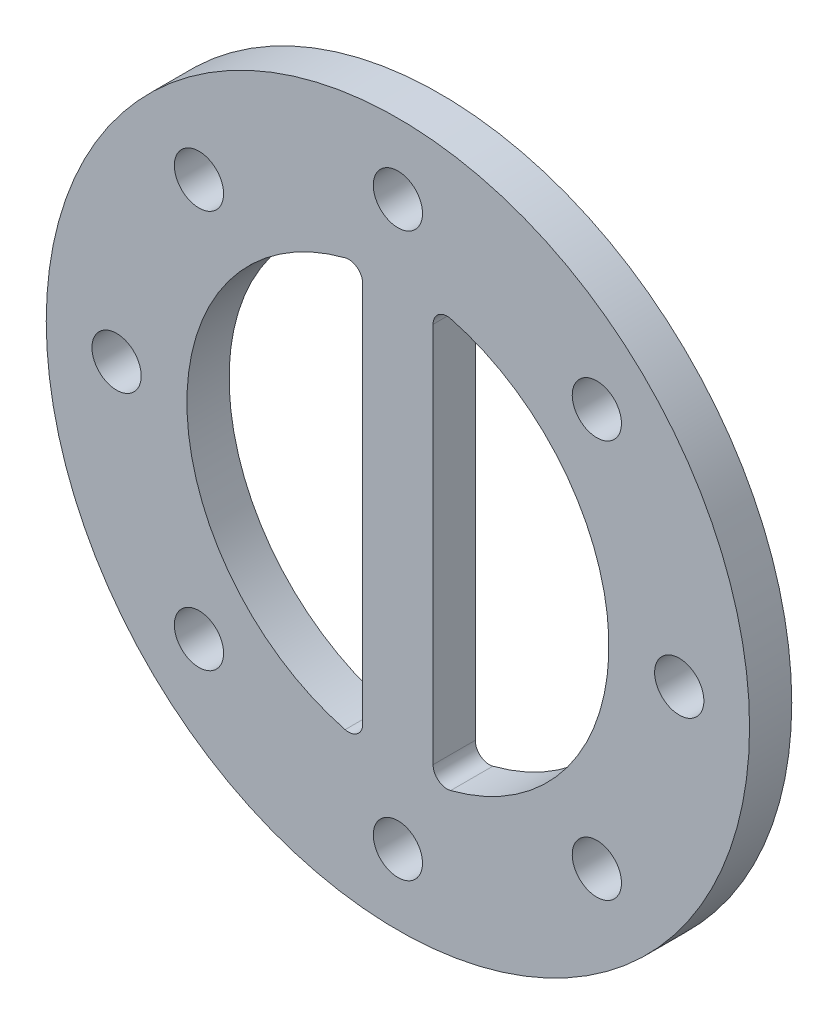
from build123d import *

# Parameters (mm, degrees)
SKETCH1_R           = 25
BOSS_EXTRUDE1_DEPTH = 3
SKETCH2_R           = 1.75
CUT_EXTRUDE1_DEPTH  = 3
CIRPATTERN1_COUNT   = 8
CUT_EXTRUDE2_DEPTH  = 10
FILLET1_R           = 1


with BuildPart() as part:
    # Sketch1 → Boss-Extrude1 (new body)
    with BuildSketch(Plane.XY):
        Circle(SKETCH1_R)
    extrude(amount=BOSS_EXTRUDE1_DEPTH)

    # Sketch2 → Cut-Extrude1 (cut)
    with BuildSketch(Plane.XY.offset(3)):
        with Locations((0, 20)):
            Circle(SKETCH2_R)
    cut_extrude1 = extrude(amount=-CUT_EXTRUDE1_DEPTH, mode=Mode.SUBTRACT)

    # CirPattern1: Cut-Extrude1 ×8 about axis
    cirpattern1_axis = Axis((0, 0, 0), (0, 0, 1))
    for i in range(1, CIRPATTERN1_COUNT):
        add(cut_extrude1.rotate(cirpattern1_axis, i * 360 / CIRPATTERN1_COUNT), mode=Mode.SUBTRACT)

    # Sketch3 → Cut-Extrude2 (cut)
    with BuildSketch(Plane.XY.offset(3)):
        with BuildLine():
            Line((-2.5, 14.790199458), (-2.5, -14.790199458))
            ThreePointArc((-2.5, -14.790199458), (-15, 0), (-2.5, 14.790199458))
        make_face()
        with BuildLine():
            Line((2.5, 14.790199458), (2.5, -14.790199458))
            ThreePointArc((2.5, -14.790199458), (15, 0), (2.5, 14.790199458))
        make_face()
    extrude(amount=-CUT_EXTRUDE2_DEPTH, mode=Mode.SUBTRACT)

    # Fillet1
    fillet1_edges = [part.edges().sort_by_distance(p)[0] for p in [
        (-2.5, -14.790199458, 1.5),
        (-2.5, 14.790199458, 1.5),
        (2.5, 14.790199458, 1.5),
        (2.5, -14.790199458, 1.5),
    ]]
    fillet(fillet1_edges, radius=FILLET1_R)


solid = part.part
